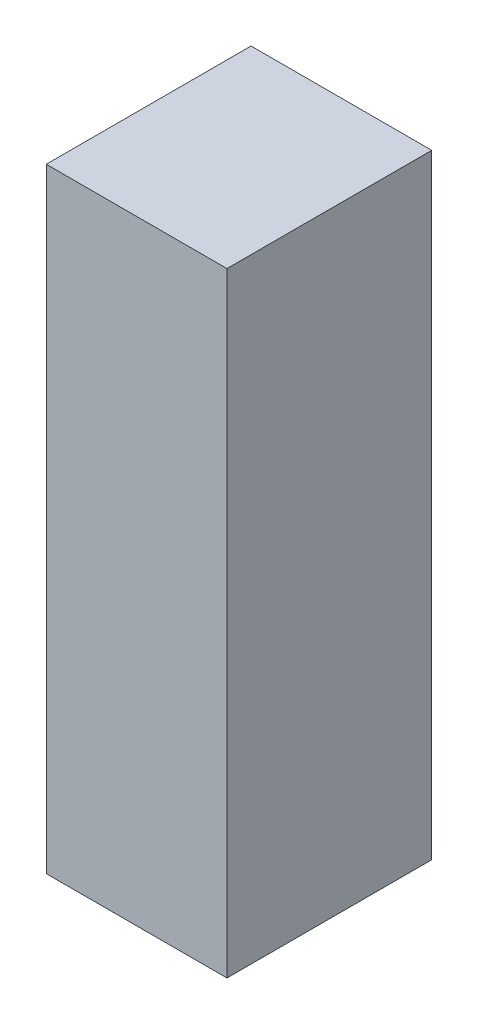
from build123d import *

# Parameters (mm, degrees)
SKETCH1_W      = 30
SKETCH1_H      = 34
EXTRUDE1_DEPTH = 102


with BuildPart() as part:
    # Sketch1 → Extrude1 (new body)
    with BuildSketch(Plane(origin=(0, 0, 0), x_dir=(1, 0, 0), z_dir=(0, 1, 0))):
        with Locations((-31.891933505, -6.20590566)):
            Rectangle(SKETCH1_W, SKETCH1_H)
    extrude(amount=EXTRUDE1_DEPTH)


solid = part.part
